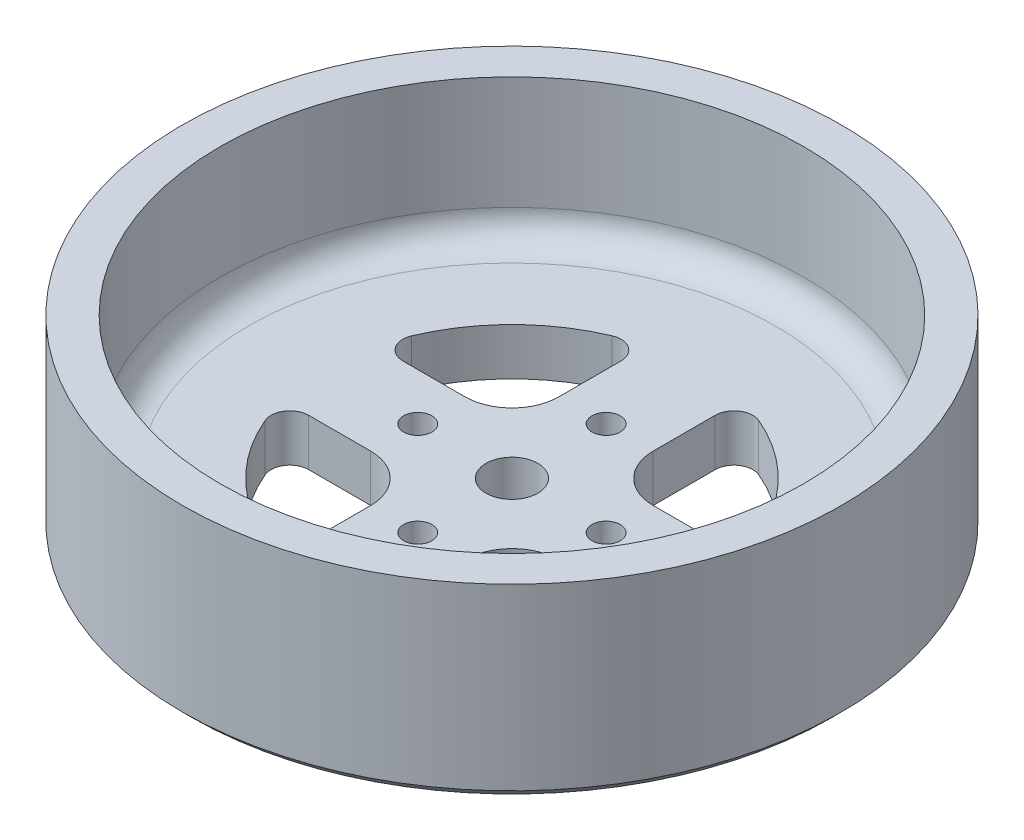
from build123d import *

# Parameters (mm, degrees)
SKETCH_1_R      = 31
SKETCH_1_R_2    = 1.5
SKETCH_1_R_3    = 2.75
EXTRUDE_1_DEPTH = 5
SKETCH_1_4_R    = 35
SKETCH_1_4_R_2  = 31
EXTRUDE_3_DEPTH = 20
FILLET_1_R      = 5
FILLET_2_R      = 2
CHAMFER_1_SIZE  = 1
FILLET_3_R      = 3


with BuildPart() as part:
    # 草图1 → 凸台-拉伸1 (new body)
    with BuildSketch(Plane(origin=(0, 0, 0), x_dir=(1, 0, 0), z_dir=(0, 1, 0))):
        Circle(SKETCH_1_R)
        with BuildLine():
            Line((-5, -5), (-5, -19.364916731))
            ThreePointArc((-5, -19.364916731), (-14.142135624, -14.142135624), (-19.364916731, -5))
            Line((-19.364916731, -5), (-5, -5))
        make_face(mode=Mode.SUBTRACT)
        with Locations((0, -10)):
            Circle(SKETCH_1_R_2, mode=Mode.SUBTRACT)
        with BuildLine():
            Line((5, -5), (19.364916731, -5))
            ThreePointArc((19.364916731, -5), (14.142135624, -14.142135624), (5, -19.364916731))
            Line((5, -19.364916731), (5, -5))
        make_face(mode=Mode.SUBTRACT)
        with Locations((-10, 0)):
            Circle(SKETCH_1_R_2, mode=Mode.SUBTRACT)
        with BuildLine():
            Line((-5, 5), (-19.364916731, 5))
            ThreePointArc((-19.364916731, 5), (-14.142135624, 14.142135624), (-5, 19.364916731))
            Line((-5, 19.364916731), (-5, 5))
        make_face(mode=Mode.SUBTRACT)
        Circle(SKETCH_1_R_3, mode=Mode.SUBTRACT)
        with Locations((10, 0)):
            Circle(SKETCH_1_R_2, mode=Mode.SUBTRACT)
        with Locations((0, 10)):
            Circle(SKETCH_1_R_2, mode=Mode.SUBTRACT)
        with BuildLine():
            Line((5, 5), (5, 19.364916731))
            ThreePointArc((5, 19.364916731), (14.142135624, 14.142135624), (19.364916731, 5))
            Line((19.364916731, 5), (5, 5))
        make_face(mode=Mode.SUBTRACT)
    extrude(amount=EXTRUDE_1_DEPTH)

    # 草图1<4> → 凸台-拉伸3 (add)
    with BuildSketch(Plane(origin=(0, 0, 0), x_dir=(1, 0, 0), z_dir=(0, 1, 0))):
        Circle(SKETCH_1_4_R)
        Circle(SKETCH_1_4_R_2, mode=Mode.SUBTRACT)
    extrude(amount=EXTRUDE_3_DEPTH)

    # 圆角1
    fillet_1_edges = [part.edges().sort_by_distance(p)[0] for p in [
        (-5, 2.5, 5),
        (5, 2.5, 5),
        (5, 2.5, -5),
        (-5, 2.5, -5),
    ]]
    fillet(fillet_1_edges, radius=FILLET_1_R)

    # 圆角2
    fillet_2_edges = [part.edges().sort_by_distance(p)[0] for p in [
        (5, 2.5, 19.364916731),
        (19.364916731, 2.5, 5),
        (19.364916731, 2.5, -5),
        (5, 2.5, -19.364916731),
        (-5, 2.5, 19.364916731),
        (-19.364916731, 2.5, 5),
        (-5, 2.5, -19.364916731),
        (-19.364916731, 2.5, -5),
    ]]
    fillet(fillet_2_edges, radius=FILLET_2_R)

    # 倒角1
    chamfer_1_edges = [part.edges().sort_by_distance(p)[0] for p in [
        (-35, 0, 0),
    ]]
    chamfer(chamfer_1_edges, length=CHAMFER_1_SIZE)

    # 圆角3
    fillet_3_edges = [part.edges().sort_by_distance(p)[0] for p in [
        (-31, 5, 0),
    ]]
    fillet(fillet_3_edges, radius=FILLET_3_R)


solid = part.part
